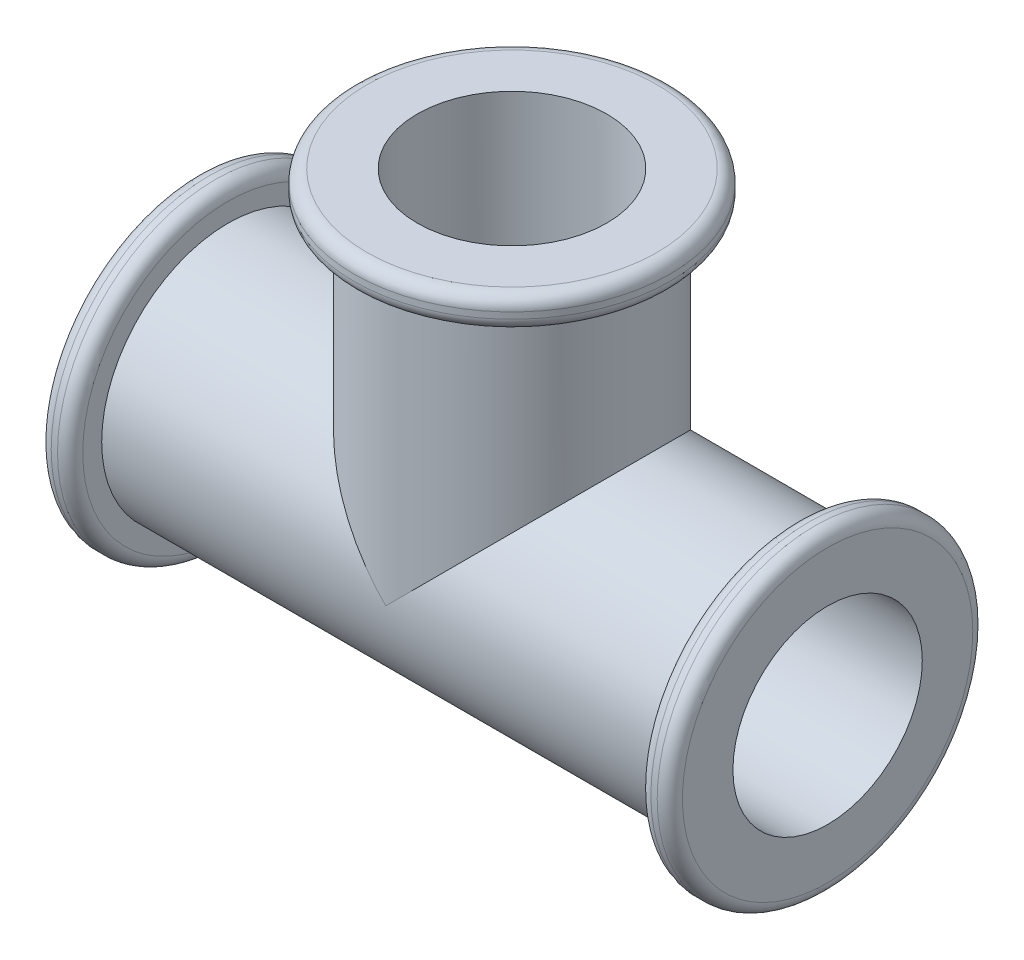
from build123d import *

# Parameters (mm, degrees)
SKETCH1_R                = 10
SKETCH1_R_2              = 7.5
BOSS_EXTRUDE1_DEPTH      = 25
SKETCH2_R                = 12.5
BOSS_EXTRUDE2_DEPTH      = 2.5
BOSS_EXTRUDE3_REACH      = 48.771
BOSS_EXTRUDE3_END_RADIUS = 10
SKETCH3_R                = 10
SKETCH3_R_2              = 7.5
SKETCH5_R                = 12.5
SKETCH5_R_2              = 7.5
BOSS_EXTRUDE4_DEPTH      = 2.5
HOLE1_D                  = 15
FILLET1_R                = 1


with BuildPart() as part:
    # Sketch1 → Boss-Extrude1 (new, symmetric)
    with BuildSketch(Plane(origin=(0, 0, 0), x_dir=(0, 0, -1), z_dir=(1, 0, 0))):
        Circle(SKETCH1_R)
        Circle(SKETCH1_R_2, mode=Mode.SUBTRACT)
    extrude(amount=BOSS_EXTRUDE1_DEPTH, both=True)

    # Sketch2 → Boss-Extrude2 (add)
    with BuildSketch(Plane(origin=(25, 0, 0), x_dir=(0, 0, -1), z_dir=(1, 0, 0))):
        Circle(SKETCH2_R)
    boss_extrude2 = extrude(amount=-BOSS_EXTRUDE2_DEPTH)

    # Mirror1: Boss-Extrude2 across plane
    add(boss_extrude2.mirror(Plane(origin=(0, 0, 0), x_dir=(0, 0, 1), z_dir=(1, 0, 0))))

    # Boss-Extrude3: up to this cylinder (the profile starts outside it)
    boss_extrude3_end = Plane(origin=(0, 0, 0), z_dir=(-1, 0, 0)) * Cylinder(BOSS_EXTRUDE3_END_RADIUS, 118.542, mode=Mode.PRIVATE)
    # Sketch3 → Boss-Extrude3 (add, up to the surface)
    with BuildSketch(Plane(origin=(0, 25, 0), x_dir=(1, 0, 0), z_dir=(0, 1, 0)), mode=Mode.PRIVATE) as boss_extrude3_sk1:
        with Locations(Location((0, 0, 0), (0, 0, 270))):
            Circle(SKETCH3_R)
        with Locations(Location((0, 0, 0), (0, 0, 270))):
            Circle(SKETCH3_R_2, mode=Mode.SUBTRACT)
    boss_extrude3_tool1 = extrude(boss_extrude3_sk1.sketch, amount=-BOSS_EXTRUDE3_REACH, mode=Mode.PRIVATE) - boss_extrude3_end
    add(boss_extrude3_tool1.solids().sort_by_distance((0, 25, -9.717157))[0])

    # Sketch5 → Boss-Extrude4 (add)
    with BuildSketch(Plane(origin=(0, 25, 0), x_dir=(1, 0, 0), z_dir=(0, 1, 0))):
        with Locations(Location((0, 0, 0), (0, 0, 270))):
            Circle(SKETCH5_R)
        with Locations(Location((0, 0, 0), (0, 0, 270))):
            Circle(SKETCH5_R_2, mode=Mode.SUBTRACT)
    extrude(amount=-BOSS_EXTRUDE4_DEPTH)

    # Hole1 (through all)
    with Locations(Plane(origin=(25, 0, 0), x_dir=(0, 0, -1), z_dir=(1, 0, 0))):
        with Locations((0, 0)):
            Hole(HOLE1_D / 2)

    # Fillet1
    fillet1_edges = [part.edges().sort_by_distance(p)[0] for p in [
        (22.5, 0, 12.5),
        (25, 0, 12.5),
        (-25, 0, 12.5),
        (-22.5, 0, 12.5),
        (0, 22.5, -12.5),
        (0, 25, -12.5),
    ]]
    fillet(fillet1_edges, radius=FILLET1_R)


solid = part.part
